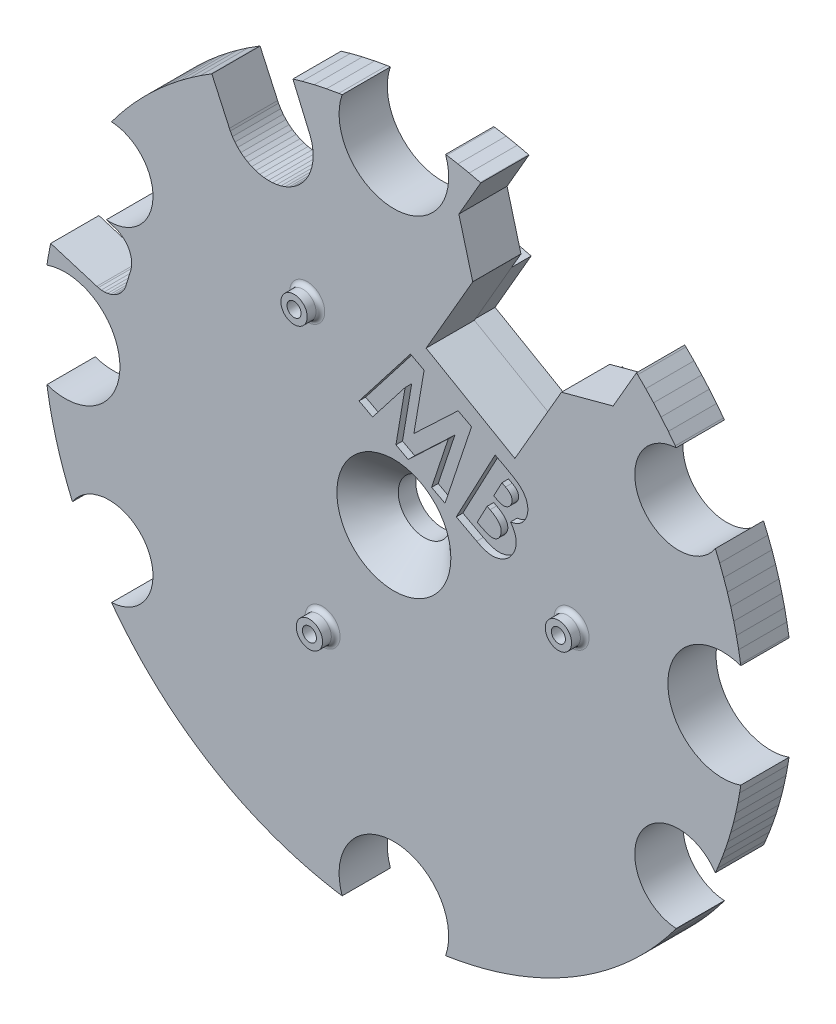
from build123d import *

# Parameters (mm, degrees)
SLOTY_MANDARYNA_DEPTH   = 5
SLOTY_MANDARYNA_2_DEPTH = 5
SLOTY_MANDARYNA_3_DEPTH = 5
SLOTY_MANDARYNA_4_DEPTH = 5
SLOTY_MANDARYNA_5_DEPTH = 5
SLOTY_MANDARYNA_6_DEPTH = 5
BOSS_EXTRUDE2_START     = 5
BOSS_EXTRUDE2_DEPTH     = 11
BOSS_EXTRUDE3_START     = 16
OTWORY_R                = 3
OTWORY_R_2              = 1.6
BOSS_EXTRUDE3_DEPTH     = 3
SKETCH3_R               = 1.6
CUT_EXTRUDE1_DEPTH      = 114.520311963
SKETCH4_R               = 6
CUT_EXTRUDE2_DEPTH      = 114.056893766
CHAMFER1_SIZE           = 7
CUT_EXTRUDE3_DEPTH      = 1.5
FILLET1_R               = 1


with BuildPart() as part:
    # mandaryna sloty → sloty_mandaryna (new body)
    with BuildSketch(Plane.XY):
        with BuildLine():
            Line((16.267033731, -5.638999554), (49.173166368, -24.63736409))
            ThreePointArc((49.173166368, -24.63736409), (55, 0), (49.173166368, 24.63736409))
            Line((49.173166368, 24.63736409), (16.267033731, 5.638999554))
            ThreePointArc((16.267033731, 5.638999554), (13.011355821, 0), (16.267033731, -5.638999554))
        make_face()
    extrude(amount=SLOTY_MANDARYNA_DEPTH)



with BuildPart() as body_2:
    # mandaryna sloty → sloty_mandaryna 2 (new body)
    with BuildSketch(Plane.XY):
        with BuildLine():
            Line((13.017033731, 11.268164679), (45.923166368, 30.266529215))
            ThreePointArc((45.923166368, 30.266529215), (41.428025521, 36.176217346), (36.177857812, 41.426592959))
            Line((36.177857812, 41.426592959), (27.670727401, 26.691810862))
            Line((27.670727401, 26.691810862), (7.087035604, 38.575810862))
            Line((7.087035604, 38.575810862), (15.313839851, 52.8250538))
            ThreePointArc((15.313839851, 52.8250538), (9.339937415, 54.201158374), (3.25, 54.903893305))
            Line((3.25, 54.903893305), (3.25, 16.907164233))
            ThreePointArc((3.25, 16.907164233), (6.50567791, 11.268164679), (13.017033731, 11.268164679))
        make_face()
    extrude(amount=SLOTY_MANDARYNA_2_DEPTH)


with BuildPart() as body_3:
    # mandaryna sloty → sloty_mandaryna 3 (new body)
    with BuildSketch(Plane.XY):
        with BuildLine():
            Line((-3.25, 16.907164233), (-3.25, 54.903893305))
            ThreePointArc((-3.25, 54.903893305), (-27.5, 47.631397208), (-45.923166368, 30.266529215))
            Line((-45.923166368, 30.266529215), (-13.017033731, 11.268164679))
            ThreePointArc((-13.017033731, 11.268164679), (-6.50567791, 11.268164679), (-3.25, 16.907164233))
        make_face()
    extrude(amount=SLOTY_MANDARYNA_3_DEPTH)


with BuildPart() as body_4:
    # mandaryna sloty → sloty_mandaryna 4 (new body)
    with BuildSketch(Plane.XY):
        with BuildLine():
            Line((-16.267033731, 5.638999554), (-49.173166368, 24.63736409))
            ThreePointArc((-49.173166368, 24.63736409), (-55, 0), (-49.173166368, -24.63736409))
            Line((-49.173166368, -24.63736409), (-16.267033731, -5.638999554))
            ThreePointArc((-16.267033731, -5.638999554), (-13.011355821, 0), (-16.267033731, 5.638999554))
        make_face()
    extrude(amount=SLOTY_MANDARYNA_4_DEPTH)


with BuildPart() as body_5:
    # mandaryna sloty → sloty_mandaryna 5 (new body)
    with BuildSketch(Plane.XY):
        with BuildLine():
            Line((-13.017033731, -11.268164679), (-45.923166368, -30.266529215))
            ThreePointArc((-45.923166368, -30.266529215), (-27.5, -47.631397208), (-3.25, -54.903893305))
            Line((-3.25, -54.903893305), (-3.25, -16.907164233))
            ThreePointArc((-3.25, -16.907164233), (-6.50567791, -11.268164679), (-13.017033731, -11.268164679))
        make_face()
    extrude(amount=SLOTY_MANDARYNA_5_DEPTH)


with BuildPart() as body_6:
    # mandaryna sloty → sloty_mandaryna 6 (new body)
    with BuildSketch(Plane.XY):
        with BuildLine():
            Line((3.25, -16.907164233), (3.25, -54.903893305))
            ThreePointArc((3.25, -54.903893305), (27.5, -47.631397208), (45.923166368, -30.266529215))
            Line((45.923166368, -30.266529215), (13.017033731, -11.268164679))
            ThreePointArc((13.017033731, -11.268164679), (6.50567791, -11.268164679), (3.25, -16.907164233))
        make_face()
    extrude(amount=SLOTY_MANDARYNA_6_DEPTH)


with BuildPart() as part_1:
    add(part.part)

    add(body_2.part)  # Boss-Extrude2 merges body 2

    add(body_3.part)  # Boss-Extrude2 merges body 3

    add(body_4.part)  # Boss-Extrude2 merges body 4

    add(body_5.part)  # Boss-Extrude2 merges body 5

    add(body_6.part)  # Boss-Extrude2 merges body 6
    # szkic Koslau → Boss-Extrude2 (add)
    with BuildSketch(Plane.XY.offset(BOSS_EXTRUDE2_START)):
        with BuildLine():
            Line((-65.612082305, 27.521816037), (-63.602639041, 26.90746777))
            Line((-63.602639041, 26.90746777), (-63.26768034, 26.805059053))
            Line((-63.26768034, 26.805059053), (-62.630226477, 26.514554213))
            Line((-62.630226477, 26.514554213), (-62.036145668, 26.143331957))
            Line((-62.036145668, 26.143331957), (-61.495601242, 25.697741087))
            Line((-61.495601242, 25.697741087), (-61.017841293, 25.185405753))
            Line((-61.017841293, 25.185405753), (-60.611042687, 24.615094327))
            Line((-60.611042687, 24.615094327), (-60.282165565, 23.996565011))
            Line((-60.282165565, 23.996565011), (-60.036835946, 23.340398336))
            Line((-60.036835946, 23.340398336), (-59.879251343, 22.657825355))
            Line((-59.879251343, 22.657825355), (-59.812111105, 21.960523178))
            Line((-59.812111105, 21.960523178), (-59.836558683, 21.260420331))
            Line((-59.836558683, 21.260420331), (-59.952182202, 20.569497642))
            Line((-59.952182202, 20.569497642), (-60.054579239, 20.23454393))
            Line((-60.054579239, 20.23454393), (-61.088410926, 16.853047205))
            Line((-61.088410926, 16.853047205), (-61.190819644, 16.518088499))
            Line((-61.190819644, 16.518088499), (-61.481324485, 15.880634635))
            Line((-61.481324485, 15.880634635), (-61.852546741, 15.286553827))
            Line((-61.852546741, 15.286553827), (-62.298137611, 14.746009401))
            Line((-62.298137611, 14.746009401), (-62.810470745, 14.268248182))
            Line((-62.810470745, 14.268248182), (-63.380782171, 13.861449576))
            Line((-63.380782171, 13.861449576), (-63.999311488, 13.532572454))
            Line((-63.999311488, 13.532572454), (-64.655475963, 13.287241565))
            Line((-64.655475963, 13.287241565), (-65.338051144, 13.129658232))
            Line((-65.338051144, 13.129658232), (-66.03535459, 13.062515794))
            Line((-66.03535459, 13.062515794), (-66.735455238, 13.086962102))
            Line((-66.735455238, 13.086962102), (-67.426375727, 13.202584351))
            Line((-67.426375727, 13.202584351), (-67.761326898, 13.304985787))
            Line((-67.761326898, 13.304985787), (-78.287366807, 16.52312154))
            Line((-78.287366807, 16.52312154), (-78.397224269, 16.030735234))
            Line((-78.397224269, 16.030735234), (-78.918523299, 13.227848028))
            Line((-78.918523299, 13.227848028), (-79.132185356, 11.797246433))
            ThreePointArc((-79.132185356, 11.797246433), (-62.49999579, -5.1859e-05), (-79.132284364, -11.797210565))
            Line((-79.132284364, -11.797210565), (-78.944264854, -13.071950573))
            Line((-78.944264854, -13.071950573), (-78.433583708, -15.850739881))
            Line((-78.433583708, -15.850739881), (-77.825119973, -18.609765699))
            Line((-77.825119973, -18.609765699), (-77.119635903, -21.345593406))
            Line((-77.119635903, -21.345593406), (-76.318012311, -24.054810856))
            Line((-76.318012311, -24.054810856), (-75.42124231, -26.734037851))
            Line((-75.42124231, -26.734037851), (-74.430450273, -29.379938663))
            Line((-74.430450273, -29.379938663), (-73.346868473, -31.989212051))
            Line((-73.346868473, -31.989212051), (-73.326163133, -32.034488003))
            ThreePointArc((-73.326163133, -32.034488003), (-56.294776324, -32.494591487), (-64.393290534, -47.484384662))
            Line((-64.393290534, -47.484384662), (-63.291280522, -48.962092421))
            Line((-63.291280522, -48.962092421), (-61.523342834, -51.165918401))
            Line((-61.523342834, -51.165918401), (-59.678704473, -53.305957518))
            Line((-59.678704473, -53.305957518), (-57.759667932, -55.379543007))
            Line((-57.759667932, -55.379543007), (-55.76862238, -57.38408711))
            Line((-55.76862238, -57.38408711), (-53.70805475, -59.317095203))
            Line((-53.70805475, -59.317095203), (-51.580530785, -61.176153281))
            Line((-51.580530785, -61.176153281), (-49.388702992, -62.958946823))
            Line((-49.388702992, -62.958946823), (-47.135304297, -64.663249792))
            Line((-47.135304297, -64.663249792), (-44.823145592, -66.286940721))
            Line((-44.823145592, -66.286940721), (-42.455104991, -67.827994246))
            Line((-42.455104991, -67.827994246), (-40.034137304, -69.284487367))
            Line((-40.034137304, -69.284487367), (-37.56326338, -70.654611473))
            Line((-37.56326338, -70.654611473), (-35.045559611, -71.936649066))
            Line((-35.045559611, -71.936649066), (-32.484165637, -73.129007445))
            Line((-32.484165637, -73.129007445), (-29.882275121, -74.230197635))
            Line((-29.882275121, -74.230197635), (-27.243131095, -75.238851733))
            Line((-27.243131095, -75.238851733), (-24.570023674, -76.153703707))
            Line((-24.570023674, -76.153703707), (-21.866287358, -76.973620277))
            Line((-21.866287358, -76.973620277), (-19.135290526, -77.697577649))
            Line((-19.135290526, -77.697577649), (-16.380438324, -78.324671588))
            Line((-16.380438324, -78.324671588), (-13.60516479, -78.854119021))
            Line((-13.60516479, -78.854119021), (-11.796841823, -79.13334032))
            ThreePointArc((-11.796841823, -79.13334032), (0.002048814, -62.499995958), (11.795484657, -79.137208343))
            Line((11.795484657, -79.137208343), (12.322338957, -79.064517299))
            Line((12.322338957, -79.064517299), (15.081760393, -78.584847372))
            Line((15.081760393, -78.584847372), (17.82270585, -78.008903699))
            Line((17.82270585, -78.008903699), (20.541817226, -77.337387125))
            Line((20.541817226, -77.337387125), (23.235762947, -76.571125263))
            Line((23.235762947, -76.571125263), (25.901240263, -75.711053285))
            Line((25.901240263, -75.711053285), (28.534985901, -74.758225946))
            Line((28.534985901, -74.758225946), (31.133770738, -73.71381157))
            Line((31.133770738, -73.71381157), (33.694417151, -72.579087404))
            Line((33.694417151, -72.579087404), (36.213780393, -71.355446465))
            Line((36.213780393, -71.355446465), (38.6887789, -70.044385702))
            Line((38.6887789, -70.044385702), (41.116379134, -68.647511917))
            Line((41.116379134, -68.647511917), (43.493605993, -67.166538975))
            Line((43.493605993, -67.166538975), (45.817549167, -65.603276804))
            Line((45.817549167, -65.603276804), (48.085358981, -63.959643665))
            Line((48.085358981, -63.959643665), (50.294258757, -62.237649823))
            Line((50.294258757, -62.237649823), (52.441542866, -60.439411089))
            Line((52.441542866, -60.439411089), (54.524579354, -58.567123938))
            Line((54.524579354, -58.567123938), (56.540815525, -56.62308633))
            Line((56.540815525, -56.62308633), (58.487783699, -54.609677572))
            Line((58.487783699, -54.609677572), (60.363097403, -52.529364916))
            Line((60.363097403, -52.529364916), (62.164457381, -50.384698231))
            Line((62.164457381, -50.384698231), (63.889657601, -48.178304676))
            Line((63.889657601, -48.178304676), (64.394095606, -47.48443086))
            ThreePointArc((64.394095606, -47.48443086), (56.291130294, -32.500903993), (73.318628515, -32.022961998))
            Line((73.318628515, -32.022961998), (73.819959546, -30.870292853))
            Line((73.819959546, -30.870292853), (74.664971821, -28.766354661))
            Line((74.664971821, -28.766354661), (75.450037528, -26.639318088))
            Line((75.450037528, -26.639318088), (76.174519273, -24.490891657))
            Line((76.174519273, -24.490891657), (76.837842273, -22.32280244))
            Line((76.837842273, -22.32280244), (77.439466351, -20.136788689))
            Line((77.439466351, -20.136788689), (77.978913943, -17.934607211))
            Line((77.978913943, -17.934607211), (78.455751231, -15.718025402))
            Line((78.455751231, -15.718025402), (78.869593809, -13.48882159))
            Line((78.869593809, -13.48882159), (79.134411066, -11.796466604))
            ThreePointArc((79.134411066, -11.796466604), (62.499995935, 0.001905028), (79.138007611, 11.795204287))
            Line((79.138007611, 11.795204287), (79.088477924, 12.156423578))
            Line((79.088477924, 12.156423578), (78.651867112, 14.719026588))
            Line((78.651867112, 14.719026588), (78.132247039, 17.26609794))
            Line((78.132247039, 17.26609794), (77.530162723, 19.794944356))
            Line((77.530162723, 19.794944356), (76.846251936, 22.302901125))
            Line((76.846251936, 22.302901125), (76.081237581, 24.787318912))
            Line((76.081237581, 24.787318912), (75.235927103, 27.245572896))
            Line((75.235927103, 27.245572896), (74.311210972, 29.675075375))
            Line((74.311210972, 29.675075375), (73.325015987, 32.032730748))
            ThreePointArc((73.325015987, 32.032730748), (56.292943244, 32.497763241), (64.398510624, 47.484675351))
            Line((64.398510624, 47.484675351), (64.189091744, 47.775796192))
            Line((64.189091744, 47.775796192), (62.603322078, 49.835629962))
            Line((62.603322078, 49.835629962), (60.95148288, 51.842866784))
            Line((60.95148288, 51.842866784), (59.235313249, 53.79538807))
            Line((59.235313249, 53.79538807), (57.456626265, 55.691132242))
            Line((57.456626265, 55.691132242), (55.617300181, 57.528099813))
            Line((55.617300181, 57.528099813), (55.348700831, 57.779467052))
            Line((55.348700831, 57.779467052), (50.019109931, 48.548339749))
            Line((50.019109931, 48.548339749), (38.23577477, 45.391004609))
            Line((38.23577477, 45.391004609), (27.59752452, 26.965014672))
            Line((27.59752452, 26.965014672), (7.360242885, 38.649014672))
            Line((7.360242885, 38.649014672), (17.993490945, 57.066345642))
            Line((17.993490945, 57.066345642), (17.984832908, 57.071344362))
            Line((17.984832908, 57.071344362), (14.823837521, 68.868339749))
            Line((14.823837521, 68.868339749), (19.819876891, 77.521738855))
            Line((19.819876891, 77.521738855), (19.69536496, 77.555521104))
            Line((19.69536496, 77.555521104), (17.165745363, 78.154355799))
            Line((17.165745363, 78.154355799), (14.618008494, 78.670705657))
            Line((14.618008494, 78.670705657), (12.05484593, 79.104025628))
            Line((12.05484593, 79.104025628), (11.794733871, 79.139351649))
            ThreePointArc((11.794733871, 79.139351649), (0.002312014, 62.499996004), (-11.796262723, 79.134989352))
            Line((-11.796262723, 79.134989352), (-12.564582465, 79.026828235))
            Line((-12.564582465, 79.026828235), (-15.371748472, 78.529090046))
            Line((-15.371748472, 78.529090046), (-18.159401733, 77.931666844))
            Line((-18.159401733, 77.931666844), (-20.924005239, 77.235320428))
            Line((-20.924005239, 77.235320428), (-23.039986666, 76.621411569))
            Line((-23.039986666, 76.621411569), (-19.234832848, 67.737983952))
            Line((-19.234832848, 67.737983952), (-19.042658929, 67.289926104))
            Line((-19.042658929, 67.289926104), (-18.747303444, 66.360671651))
            Line((-18.747303444, 66.360671651), (-18.543739665, 65.407095017))
            Line((-18.543739665, 65.407095017), (-18.433903333, 64.438238605))
            Line((-18.433903333, 64.438238605), (-18.418832579, 63.463292357))
            Line((-18.418832579, 63.463292357), (-18.498669899, 62.491503982))
            Line((-18.498669899, 62.491503982), (-18.672660664, 61.532090097))
            Line((-18.672660664, 61.532090097), (-18.939154751, 60.594152119))
            Line((-18.939154751, 60.594152119), (-19.295622397, 59.686582764))
            Line((-19.295622397, 59.686582764), (-19.738682233, 58.817997179))
            Line((-19.738682233, 58.817997179), (-20.264133891, 57.996625649))
            Line((-20.264133891, 57.996625649), (-20.866989422, 57.230264279))
            Line((-20.866989422, 57.230264279), (-21.541537039, 56.526179816))
            Line((-21.541537039, 56.526179816), (-22.281374137, 55.891052453))
            Line((-22.281374137, 55.891052453), (-23.079484493, 55.330903086))
            Line((-23.079484493, 55.330903086), (-23.928298951, 54.851049158))
            Line((-23.928298951, 54.851049158), (-24.819766607, 54.456037245))
            Line((-24.819766607, 54.456037245), (-25.745429285, 54.149615655))
            Line((-25.745429285, 54.149615655), (-26.696510571, 53.934691986))
            Line((-26.696510571, 53.934691986), (-27.663988084, 53.813304458))
            Line((-27.663988084, 53.813304458), (-28.638685553, 53.78660468))
            Line((-28.638685553, 53.78660468), (-29.611356674, 53.85484448))
            Line((-29.611356674, 53.85484448), (-30.572778363, 54.017376947))
            Line((-30.572778363, 54.017376947), (-31.51383013, 54.272661194))
            Line((-31.51383013, 54.272661194), (-32.425585374, 54.618276947))
            Line((-32.425585374, 54.618276947), (-33.299395748, 55.050940983))
            Line((-33.299395748, 55.050940983), (-34.126976944, 55.566556664))
            Line((-34.126976944, 55.566556664), (-34.900476049, 56.160229356))
            Line((-34.900476049, 56.160229356), (-35.612556648, 56.826327298))
            Line((-35.612556648, 56.826327298), (-36.2564638, 57.558536715))
            Line((-36.2564638, 57.558536715), (-36.826094084, 58.349908122))
            Line((-36.826094084, 58.349908122), (-37.316043131, 59.19293656))
            Line((-37.316043131, 59.19293656), (-37.518853039, 59.636283202))
            Line((-37.518853039, 59.636283202), (-41.525713683, 68.39534268))
            Line((-41.525713683, 68.39534268), (-41.798050826, 68.235121112))
            Line((-41.798050826, 68.235121112), (-44.202231864, 66.702859684))
            Line((-44.202231864, 66.702859684), (-46.550307828, 65.085926334))
            Line((-46.550307828, 65.085926334), (-48.839292341, 63.3863745))
            Line((-48.839292341, 63.3863745), (-51.066281409, 61.606363845))
            Line((-51.066281409, 61.606363845), (-53.228448437, 59.748148579))
            Line((-53.228448437, 59.748148579), (-55.323047943, 57.814091333))
            Line((-55.323047943, 57.814091333), (-57.347424452, 55.806647767))
            Line((-57.347424452, 55.806647767), (-59.299004625, 53.728364952))
            Line((-59.299004625, 53.728364952), (-61.175312067, 51.58188113))
            Line((-61.175312067, 51.58188113), (-62.973964202, 49.369920968))
            Line((-62.973964202, 49.369920968), (-64.398459589, 47.48467371))
            ThreePointArc((-64.398459589, 47.48467371), (-54.970334354, 36.893180563), (-65.612082305, 27.521816037))
        make_face()
    extrude(amount=BOSS_EXTRUDE2_DEPTH)

    # otwory → Boss-Extrude3 (add)
    # profile 1 of 3: a face of its own
    with BuildSketch(Plane.XY.offset(BOSS_EXTRUDE3_START)):
        with Locations((-19.770010135, 34.242663145)):
            Circle(OTWORY_R)
        with Locations((-19.770010135, 34.242663145)):
            Circle(OTWORY_R_2, mode=Mode.SUBTRACT)
    # profile 2 of 3: a face of its own
    with BuildSketch(Plane.XY.offset(BOSS_EXTRUDE3_START)):
        with Locations((40.540020027, 1.11e-07)):
            Circle(OTWORY_R)
        with Locations((40.540020027, 1.11e-07)):
            Circle(OTWORY_R_2, mode=Mode.SUBTRACT)
    # profile 3 of 3: a face of its own
    with BuildSketch(Plane.XY.offset(BOSS_EXTRUDE3_START)):
        with Locations((-16.270008662, -28.180480518)):
            Circle(OTWORY_R)
        with Locations((-16.270008662, -28.180480518)):
            Circle(OTWORY_R_2, mode=Mode.SUBTRACT)
    extrude(amount=BOSS_EXTRUDE3_DEPTH)

    # Sketch3 → Cut-Extrude1 (cut, through all)
    with BuildSketch(Plane.XY.offset(19)):
        with Locations((-16.270008662, -28.180480518)):
            Circle(SKETCH3_R)
        with Locations((40.540020027, 1.11e-07)):
            Circle(SKETCH3_R)
        with Locations((-19.770010135, 34.242663145)):
            Circle(SKETCH3_R)
    extrude(amount=-CUT_EXTRUDE1_DEPTH, mode=Mode.SUBTRACT)

    # Sketch4 → Cut-Extrude2 (cut, through all)
    with BuildSketch(Plane.XY.offset(16)):
        Circle(SKETCH4_R)
    extrude(amount=-CUT_EXTRUDE2_DEPTH, mode=Mode.SUBTRACT)

    # Chamfer1
    chamfer1_edges = [part_1.edges().sort_by_distance(p)[0] for p in [
        (-6, 0, 16),
    ]]
    chamfer(chamfer1_edges, length=CHAMFER1_SIZE)

    # Sketch6 → Cut-Extrude3 (cut)
    # profile 1 of 2: a face of its own
    with BuildSketch(Plane.XY.offset(16)):
        Polygon((3.790119665, 35.705670431), (6.896429761, 34.053296633), (4.564789136, 20.384005767), (14.65457279, 29.928086296), (17.715089617, 28.302425239), (11.662745867, 10.145393989), (8.606045146, 11.771055046), (12.410702598, 23.246085094), (3.267313175, 14.606421633), (0.470107646, 16.094702883), (2.565149713, 28.477966104), (-4.853359902, 18.926253364), (-7.948221681, 20.57099495), align=None)
    # profile 2 of 2: a face of its own
    with BuildSketch(Plane.XY.offset(16)):
        with BuildLine():
            Line((14.230633875, 8.756154741), (23.091631471, 25.421088636))
            Line((23.091631471, 25.421088636), (25.709480029, 24.02821003))
            add(Edge.make_bspline(
                [(25.709480029, 24.02821003), (25.89174203, 23.92964735), (26.243878849, 23.739220666), (26.747711859, 23.452962799), (27.209694312, 23.178387436), (27.629489814, 22.916756433), (28.004402267, 22.66394649), (28.338247222, 22.424279694), (28.62754268, 22.193775171), (28.799977453, 22.03703799), (28.880663923, 21.963696809)],
                knots=[0, 0, 0, 0, 1.310873027, 2.532654382, 3.665769534, 4.710752264, 5.661598208, 6.526033951, 7.31029504, 8, 8, 8, 8], degree=3))
            add(Edge.make_bspline(
                [(28.880663923, 21.963696809), (28.98415906, 21.864878913), (29.188797431, 21.669488738), (29.461335808, 21.35157029), (29.70741293, 21.025341723), (29.926677334, 20.69071008), (30.110260473, 20.34117823), (30.262306304, 19.980503629), (30.390950772, 19.610613605), (30.480048637, 19.229105174), (30.54232833, 18.845391106), (30.569552966, 18.460903134), (30.560675434, 18.080551721), (30.523860738, 17.700862291), (30.447362282, 17.325205011), (30.333272008, 16.952751301), (30.195470506, 16.579880691), (30.072574651, 16.341423675), (30.010231231, 16.220457626)],
                knots=[0, 0, 0, 0, 1.0850716, 2.145485182, 3.172342438, 4.184214943, 5.177132323, 6.163036522, 7.151865, 8.14436017, 9.131255822, 10.098707103, 11.063989803, 12.014688886, 12.989429485, 13.966508338, 14.968436931, 16, 16, 16, 16], degree=3))
            add(Edge.make_bspline(
                [(30.010231231, 16.220457626), (29.923280553, 16.068214426), (29.752099267, 15.768490632), (29.440336541, 15.36108962), (29.087214805, 15.003890223), (28.692504121, 14.694794386), (28.252081992, 14.429993121), (27.754059523, 14.224361951), (27.204212711, 14.052079017), (26.813377734, 13.982336078), (26.61008099, 13.946058588)],
                knots=[0, 0, 0, 0, 0.986887386, 1.942902096, 2.880365342, 3.809326405, 4.760575215, 5.765536178, 6.83772117, 8, 8, 8, 8], degree=3))
            add(Edge.make_bspline(
                [(26.61008099, 13.946058588), (26.700358825, 13.820980518), (26.878009141, 13.574849688), (27.117890495, 13.198727658), (27.325589546, 12.824503829), (27.497134559, 12.450894027), (27.64423927, 12.082767868), (27.755036023, 11.713480471), (27.835611609, 11.347318788), (27.90172576, 10.864032265), (27.912907852, 10.25419795), (27.799341221, 9.522202559), (27.583936826, 8.784743354), (27.353905358, 8.316863335), (27.235922336, 8.076887915)],
                knots=[0, 0, 0, 0, 0.883775406, 1.73910883, 2.554696474, 3.334109333, 4.093461741, 4.824437035, 5.54072819, 6.239637335, 7.61743353, 9.017302799, 10.470176142, 12, 12, 12, 12], degree=3))
            add(Edge.make_bspline(
                [(27.235922336, 8.076887915), (27.104901476, 7.851231257), (26.846667004, 7.406475149), (26.35171332, 6.81912318), (25.792437218, 6.303744376), (25.158947605, 5.885620448), (24.486696357, 5.554026798), (23.789983368, 5.317326999), (23.078503235, 5.184024828), (22.47422963, 5.150907404), (21.980908958, 5.188405796), (21.591491138, 5.244873522), (21.185600303, 5.339247276), (20.7616333, 5.462085546), (20.318830833, 5.614092543), (19.859766641, 5.803191292), (19.383025911, 6.024947075), (19.062507646, 6.190550379), (18.897731231, 6.275685991)],
                knots=[0, 0, 0, 0, 1.297172512, 2.556651343, 3.80761204, 5.072478752, 6.321722429, 7.531548233, 8.724139552, 9.916310278, 10.532313777, 11.185338656, 11.873745601, 12.605462041, 13.382671947, 14.203686943, 15.076526804, 16, 16, 16, 16], degree=3))
            Line((18.897731231, 6.275685991), (14.230633875, 8.756154741))
        make_face()
        with BuildLine():
            Line((24.652418731, 20.708198011), (22.786343009, 17.197380703))
            Line((22.786343009, 17.197380703), (23.477058154, 16.831034549))
            add(Edge.make_bspline(
                [(23.477058154, 16.831034549), (23.660521162, 16.740477814), (24.005118685, 16.570385614), (24.524888245, 16.410026473), (25.004870821, 16.344717437), (25.445410914, 16.385028531), (25.841779915, 16.522965806), (26.191559869, 16.74369931), (26.489692996, 17.052427345), (26.639098401, 17.300781645), (26.716931952, 17.430163155)],
                knots=[0, 0, 0, 0, 1.311431857, 2.463254992, 3.47484508, 4.401718133, 5.274369769, 6.144076028, 7.033146409, 8, 8, 8, 8], degree=3))
            add(Edge.make_bspline(
                [(26.716931952, 17.430163155), (26.777130998, 17.557838637), (26.892790707, 17.803140019), (26.973026517, 18.196359957), (26.954820347, 18.583688777), (26.8551924, 18.96641282), (26.654098108, 19.33399903), (26.353119709, 19.680399591), (25.950850379, 19.999495043), (25.635956721, 20.178363152), (25.469065365, 20.273161953)],
                knots=[0, 0, 0, 0, 0.960006971, 1.844449951, 2.703745506, 3.583071127, 4.518193244, 5.533192906, 6.69261013, 8, 8, 8, 8], degree=3))
            Line((25.469065365, 20.273161953), (24.652418731, 20.708198011))
        make_face(mode=Mode.SUBTRACT)
        with BuildLine():
            Line((21.278981231, 14.365830222), (19.012214404, 10.095607866))
            Line((19.012214404, 10.095607866), (19.805964404, 9.672020126))
            add(Edge.make_bspline(
                [(19.805964404, 9.672020126), (19.96436647, 9.589419732), (20.267095423, 9.431558593), (20.710834769, 9.223810627), (21.123982564, 9.055745111), (21.505060196, 8.919874783), (21.855721657, 8.822936192), (22.175040912, 8.764837022), (22.461655404, 8.737907576), (22.719813834, 8.753631185), (22.954203749, 8.800682502), (23.171413611, 8.87383562), (23.378654141, 8.968964065), (23.566268056, 9.097107045), (23.747497466, 9.241977423), (23.904895471, 9.421191161), (24.057169929, 9.61902118), (24.140334742, 9.767503208), (24.183037721, 9.843744886)],
                knots=[0, 0, 0, 0, 1.718697909, 3.284676967, 4.711941704, 6.008608103, 7.175399273, 8.207666198, 9.128500861, 9.937736794, 10.686600878, 11.421941711, 12.139133366, 12.872332277, 13.602562966, 14.364906893, 15.160422013, 16, 16, 16, 16], degree=3))
            add(Edge.make_bspline(
                [(24.183037721, 9.843744886), (24.226933651, 9.931947013), (24.313525405, 10.105939836), (24.407910155, 10.376195887), (24.470846292, 10.644896842), (24.496814974, 10.912860661), (24.494707623, 11.17952697), (24.454202763, 11.445617155), (24.385810571, 11.711110899), (24.28129712, 11.976510307), (24.139694677, 12.241592294), (23.952594893, 12.502014043), (23.726893869, 12.76307459), (23.452367478, 13.018517809), (23.134763922, 13.272913999), (22.775862024, 13.528293938), (22.37376579, 13.781560587), (22.085154328, 13.937582102), (21.935351423, 14.018564597)],
                knots=[0, 0, 0, 0, 0.879356229, 1.734671001, 2.550584544, 3.338646253, 4.13412767, 4.926356236, 5.736632592, 6.578558473, 7.468205896, 8.413989165, 9.436962226, 10.546224232, 11.758274557, 13.069934623, 14.479158438, 16, 16, 16, 16], degree=3))
            Line((21.935351423, 14.018564597), (21.278981231, 14.365830222))
        make_face(mode=Mode.SUBTRACT)
    extrude(amount=-CUT_EXTRUDE3_DEPTH, mode=Mode.SUBTRACT)

    # Fillet1
    fillet1_edges = [part_1.edges().sort_by_distance(p)[0] for p in [
        (-22.770010135, 34.242663145, 16),
        (37.540020027, 1.11e-07, 16),
        (-19.270008662, -28.180480518, 16),
    ]]
    fillet(fillet1_edges, radius=FILLET1_R)


solid = part_1.part
